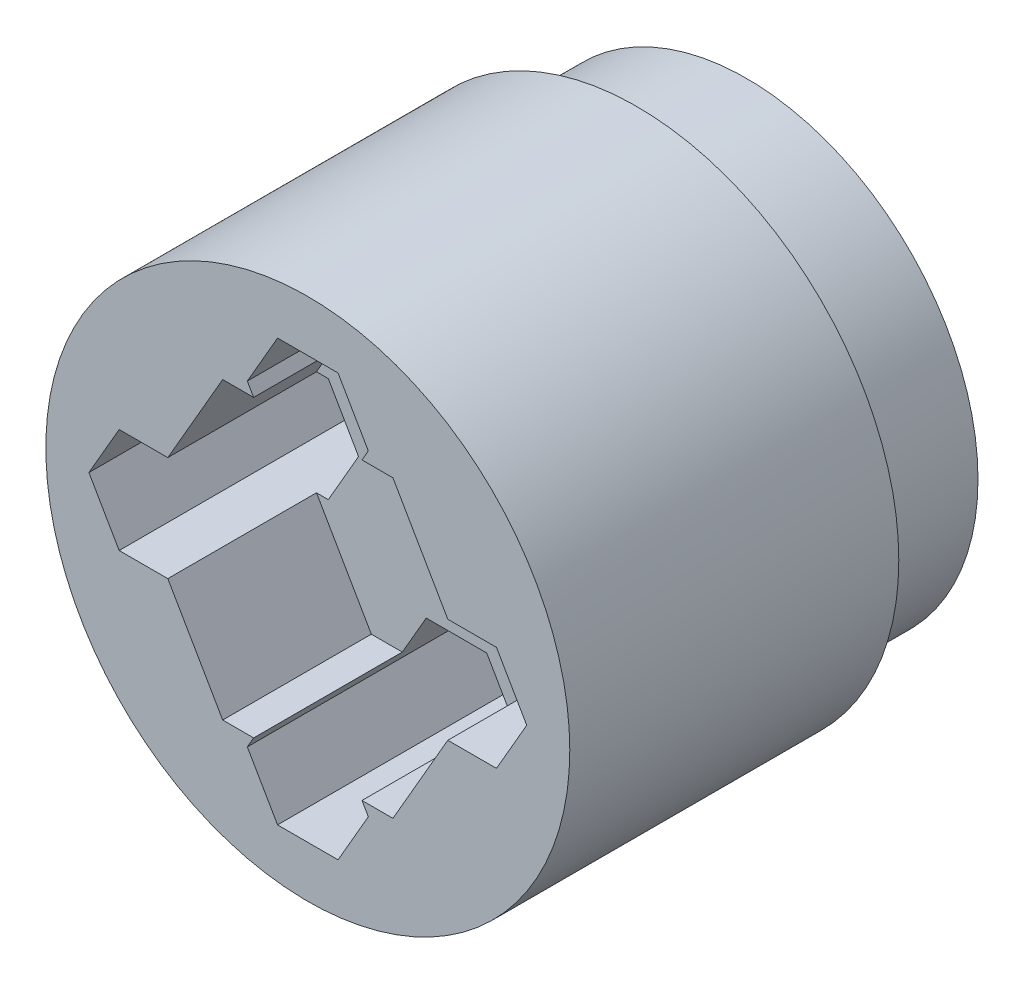
from build123d import *

# Parameters (mm, degrees)
SKETCH1_R           = 9.5
BOSS_EXTRUDE1_DEPTH = 16
SKETCH1_3_R         = 10.75
SKETCH1_3_R_2       = 9.5
BOSS_EXTRUDE2_DEPTH = 11.5
SKETCH2_R           = 2.25
CUT_EXTRUDE1_DEPTH  = 23.070908454
SKETCH3_R           = 1.35
CUT_EXTRUDE2_DEPTH  = 23.070908454
CUT_EXTRUDE7_START  = -9
SKETCH5_R           = 1.35
CUT_EXTRUDE7_DEPTH  = 9
CUT_EXTRUDE8_DEPTH  = 6.1
BOSS_EXTRUDE5_START = 2
SKETCH8_R           = 2.25
BOSS_EXTRUDE5_DEPTH = 2
BOSS_EXTRUDE6_START = 2
SKETCH9_R           = 10.75
BOSS_EXTRUDE6_DEPTH = 2


with BuildPart() as part:
    # Sketch1 → Boss-Extrude1 (new body)
    with BuildSketch(Plane.XY):
        Circle(SKETCH1_R)
    extrude(amount=-BOSS_EXTRUDE1_DEPTH)

    # Sketch1<3> → Boss-Extrude2 (add)
    with BuildSketch(Plane.XY):
        Circle(SKETCH1_3_R)
        Circle(SKETCH1_3_R_2, mode=Mode.SUBTRACT)
    extrude(amount=-BOSS_EXTRUDE2_DEPTH)

    # Sketch2 → Cut-Extrude1 (cut, through all)
    with BuildSketch(Plane.XY):
        Circle(SKETCH2_R)
    extrude(amount=-CUT_EXTRUDE1_DEPTH, mode=Mode.SUBTRACT)

    # Sketch3 → Cut-Extrude2 (cut, through all)
    with BuildSketch(Plane(origin=(0, 0, -16), x_dir=(-1, 0, 0), z_dir=(0, 0, -1))):
        with Locations((-6.5, 0)):
            Circle(SKETCH3_R)
        with Locations((0, 6.5)):
            Circle(SKETCH3_R)
        with Locations((6.5, 0)):
            Circle(SKETCH3_R)
        with Locations((0, -6.5)):
            Circle(SKETCH3_R)
    extrude(amount=-CUT_EXTRUDE2_DEPTH, mode=Mode.SUBTRACT)

    # Sketch5 → Cut-Extrude7 (cut)
    # profile 1 of 4: a face of its own
    with BuildSketch(Plane.XY.offset(CUT_EXTRUDE7_START)):
        Polygon((-1.241303079, 4.35), (1.241303079, 4.35), (2.482606158, 6.5), (1.241303079, 8.65), (-1.241303079, 8.65), (-2.482606158, 6.5), align=None)
        with Locations((0, 6.5)):
            Circle(SKETCH5_R, mode=Mode.SUBTRACT)
    # profile 2 of 4: a face of its own
    with BuildSketch(Plane.XY.offset(CUT_EXTRUDE7_START)):
        Polygon((-7.741303079, -2.15), (-5.258696921, -2.15), (-4.017393842, 0), (-5.258696921, 2.15), (-7.741303079, 2.15), (-8.982606158, 0), align=None)
    # profile 3 of 4: a face of its own
    with BuildSketch(Plane.XY.offset(CUT_EXTRUDE7_START)):
        Polygon((-1.241303079, -8.65), (1.241303079, -8.65), (2.482606158, -6.5), (1.241303079, -4.35), (-1.241303079, -4.35), (-2.482606158, -6.5), align=None)
        with Locations((0, -6.5)):
            Circle(SKETCH5_R, mode=Mode.SUBTRACT)
    # profile 4 of 4: a face of its own
    with BuildSketch(Plane.XY.offset(CUT_EXTRUDE7_START)):
        Polygon((5.258696921, -2.15), (7.741303079, -2.15), (8.982606158, 0), (7.741303079, 2.15), (5.258696921, 2.15), (4.017393842, 0), align=None)
        with Locations((6.5, 0)):
            Circle(SKETCH5_R, mode=Mode.SUBTRACT)
    extrude(amount=CUT_EXTRUDE7_DEPTH, mode=Mode.SUBTRACT)

    # Sketch6 → Cut-Extrude8 (cut)
    with BuildSketch(Plane.XY):
        Polygon((3.492969129, -6.05), (6.985938257, 0), (3.492969129, 6.05), (-3.492969129, 6.05), (-6.985938257, 0), (-3.492969129, -6.05), align=None)
    extrude(amount=-CUT_EXTRUDE8_DEPTH, mode=Mode.SUBTRACT)

    # Sketch8 → Boss-Extrude5 (add)
    with BuildSketch(Plane.XY.offset(-6.1).offset(BOSS_EXTRUDE5_START)):
        Polygon((-1.241303079, 4.35), (-2.222798536, 6.05), (-3.492969129, 6.05), (-5.744635178, 2.15), (-5.258696921, 2.15), (-4.017393842, 0), (-5.258696921, -2.15), (-5.744635178, -2.15), (-3.492969129, -6.05), (-2.222798536, -6.05), (-1.241303079, -4.35), (1.241303079, -4.35), (2.222798536, -6.05), (3.492969129, -6.05), (5.744635178, -2.15), (5.258696921, -2.15), (4.017393842, 0), (5.258696921, 2.15), (5.744635178, 2.15), (3.492969129, 6.05), (2.222798536, 6.05), (1.241303079, 4.35), align=None)
        Circle(SKETCH8_R, mode=Mode.SUBTRACT)
    extrude(amount=-BOSS_EXTRUDE5_DEPTH)

    # Sketch9 → Boss-Extrude6 (add)
    with BuildSketch(Plane.XY.offset(BOSS_EXTRUDE6_START)):
        Circle(SKETCH9_R)
        Polygon((-3.492969129, 6.05), (-5.744635178, 2.15), (-7.741303079, 2.15), (-8.982606158, 0), (-7.741303079, -2.15), (-5.744635178, -2.15), (-3.492969129, -6.05), (-2.222798536, -6.05), (-2.482606158, -6.5), (-1.241303079, -8.65), (1.241303079, -8.65), (2.482606158, -6.5), (2.222798536, -6.05), (3.492969129, -6.05), (5.744635178, -2.15), (7.741303079, -2.15), (8.982606158, 0), (7.741303079, 2.15), (5.744635178, 2.15), (3.492969129, 6.05), (2.222798536, 6.05), (2.482606158, 6.5), (1.241303079, 8.65), (-1.241303079, 8.65), (-2.482606158, 6.5), (-2.222798536, 6.05), align=None, mode=Mode.SUBTRACT)
    extrude(amount=-BOSS_EXTRUDE6_DEPTH)


solid = part.part
